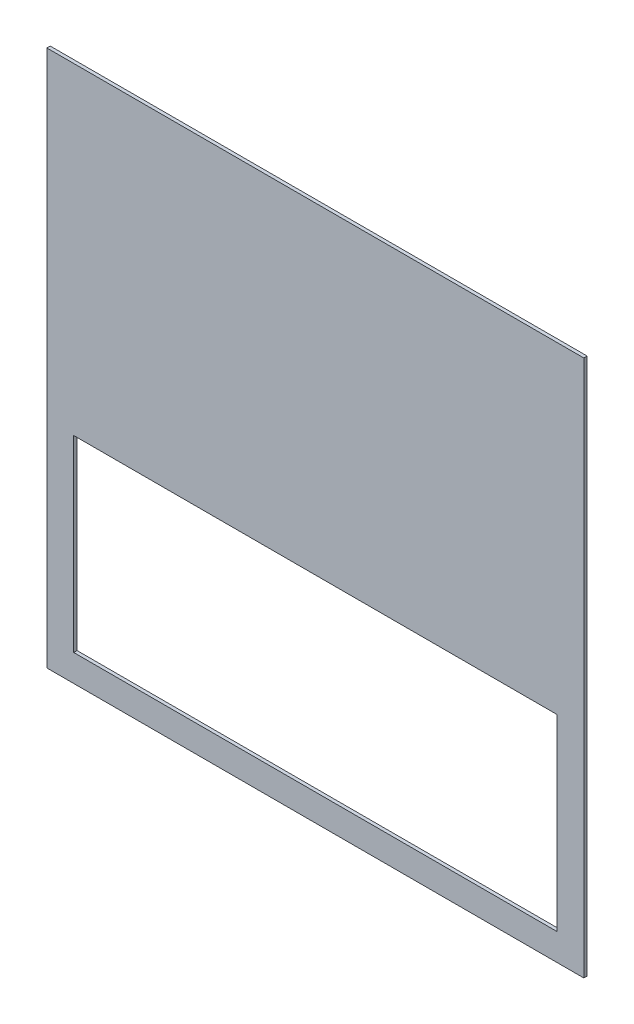
from build123d import *

# Parameters (mm, degrees)
SKETCH1_W           = 508
SKETCH1_H           = 508
BOSS_EXTRUDE1_DEPTH = 1.5875
SKETCH3_W           = 457.2
SKETCH3_H           = 177.8
CUT_EXTRUDE2_DEPTH  = 360.224276219


with BuildPart() as part:
    # Sketch1 → Boss-Extrude1 (new, symmetric)
    with BuildSketch(Plane.XY):
        Rectangle(SKETCH1_W, SKETCH1_H)
    extrude(amount=BOSS_EXTRUDE1_DEPTH, both=True)

    # Sketch3 → Cut-Extrude2 (cut, through all)
    with BuildSketch(Plane(origin=(0, 0, -1.5875), x_dir=(-1, 0, 0), z_dir=(0, 0, -1))):
        with Locations((0, -139.7)):
            Rectangle(SKETCH3_W, SKETCH3_H)
    extrude(amount=-CUT_EXTRUDE2_DEPTH, mode=Mode.SUBTRACT)


solid = part.part
